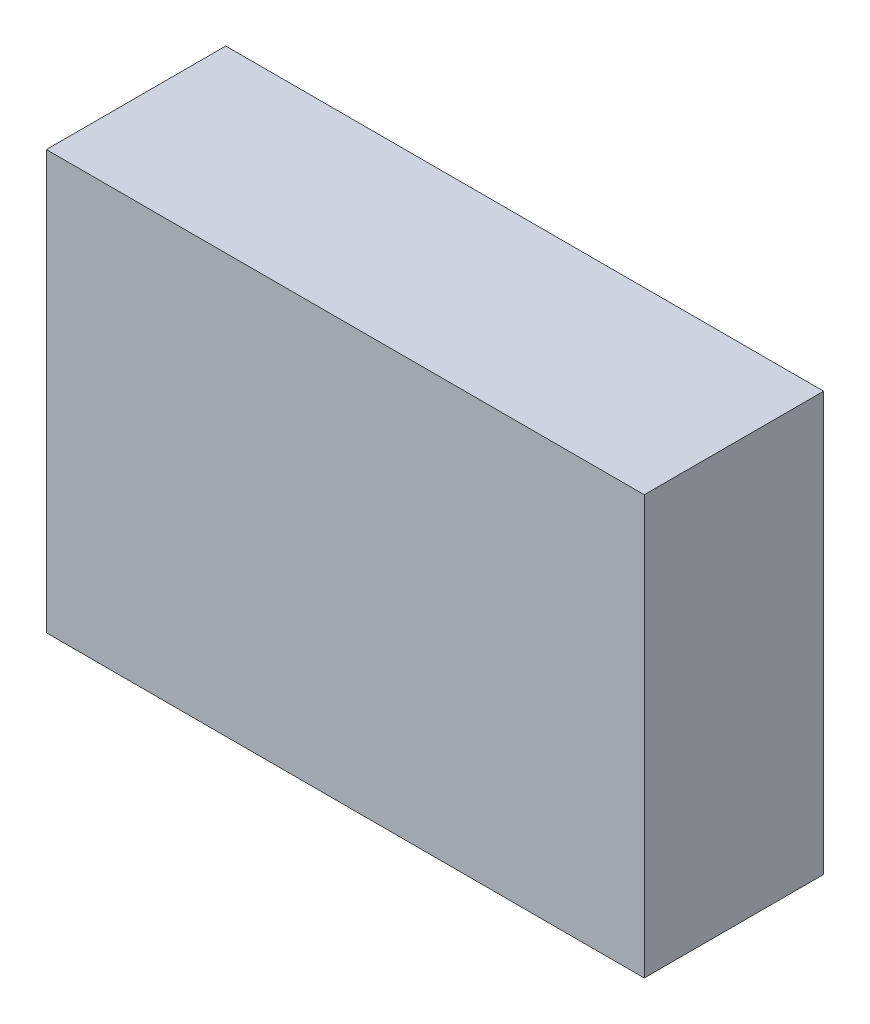
from build123d import *

# Parameters (mm, degrees)
SKETCH_1_W      = 100
SKETCH_1_H      = 70
EXTRUDE_1_DEPTH = 30


with BuildPart() as part:
    # 草圖1 → 填料-伸長1 (new body)
    with BuildSketch(Plane.XY):
        with Locations((45.113903261, -32.222921914)):
            Rectangle(SKETCH_1_W, SKETCH_1_H)
    extrude(amount=EXTRUDE_1_DEPTH)


solid = part.part
